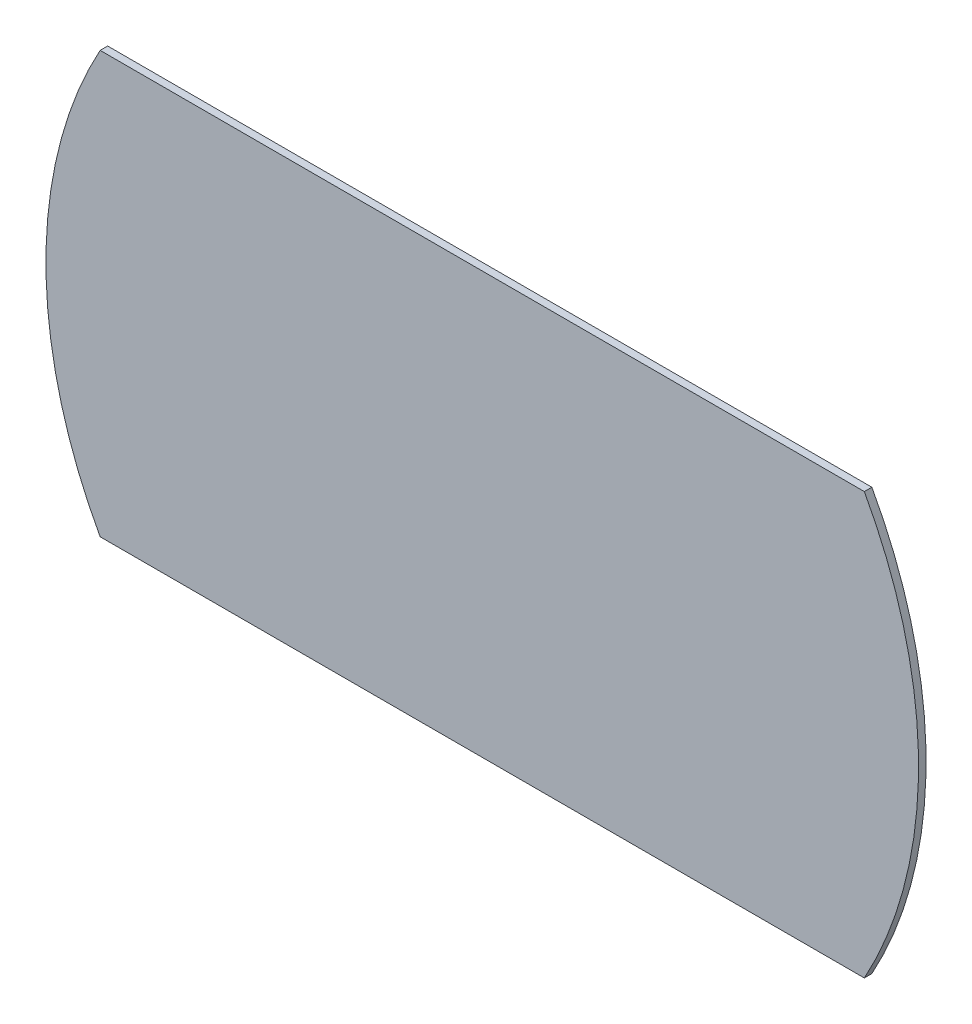
from build123d import *

# Parameters (mm, degrees)
EXTRUDE_1_DEPTH = 0.5
EXTRUDE_2_DEPTH = 0.2


with BuildPart() as part:
    # Эскиз1 → Бобышка-Вытянуть1 (new body)
    with BuildSketch(Plane.XY):
        with BuildLine():
            Line((25.396850198, 14), (-25.396850198, 14))
            ThreePointArc((-25.396850198, 14), (-29, 0), (-25.396850198, -14))
            Line((-25.396850198, -14), (25.396850198, -14))
            ThreePointArc((25.396850198, -14), (29, 0), (25.396850198, 14))
        make_face()
    extrude(amount=EXTRUDE_1_DEPTH)

    # Эскиз2 → Бобышка-Вытянуть2 (add)
    with BuildSketch(Plane(origin=(0, 0, 0), x_dir=(-1, 0, 0), z_dir=(0, 0, -1))):
        with BuildLine():
            Line((-24.494897428, -12.5), (24.494897428, -12.5))
            ThreePointArc((24.494897428, -12.5), (27.5, 0), (24.494897428, 12.5))
            Line((24.494897428, 12.5), (-24.494897428, 12.5))
            ThreePointArc((-24.494897428, 12.5), (-27.5, 0), (-24.494897428, -12.5))
        make_face()
    extrude(amount=EXTRUDE_2_DEPTH)


solid = part.part
